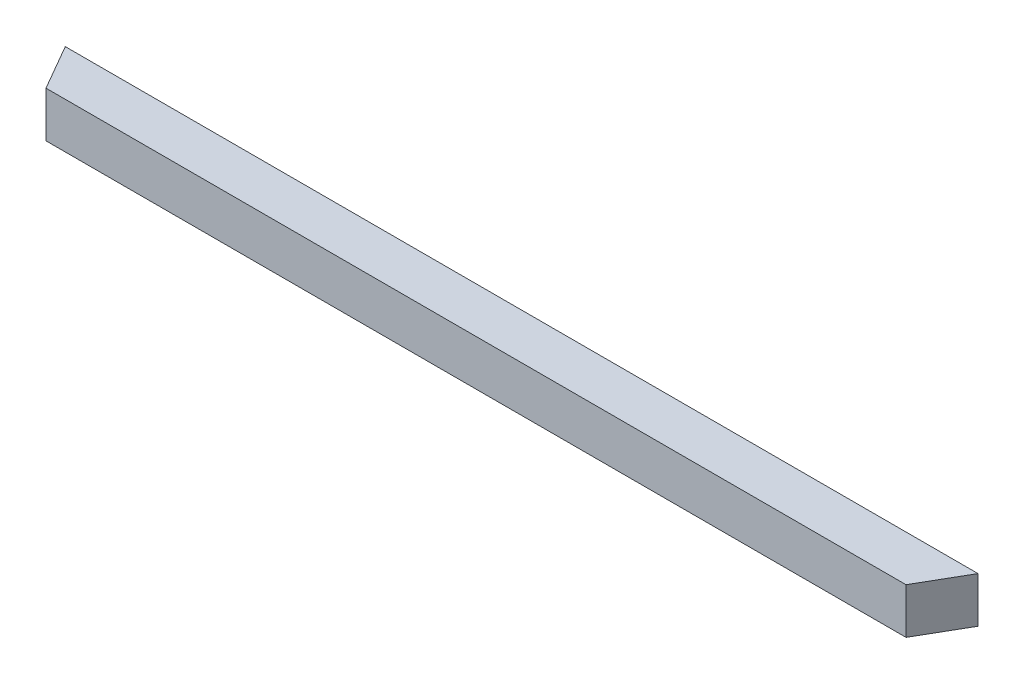
from build123d import *

# Parameters (mm, degrees)
BOSS_EXTRUDE1_DEPTH = 20


with BuildPart() as part:
    # Sketch1 → Boss-Extrude1 (new body)
    with BuildSketch(Plane(origin=(0, 0, 0), x_dir=(1, 0, 0), z_dir=(0, 1, 0))):
        Polygon((-200, 0), (200, 0), (188.452994616, -20), (-188.452994616, -20), align=None)
    extrude(amount=BOSS_EXTRUDE1_DEPTH)


solid = part.part
